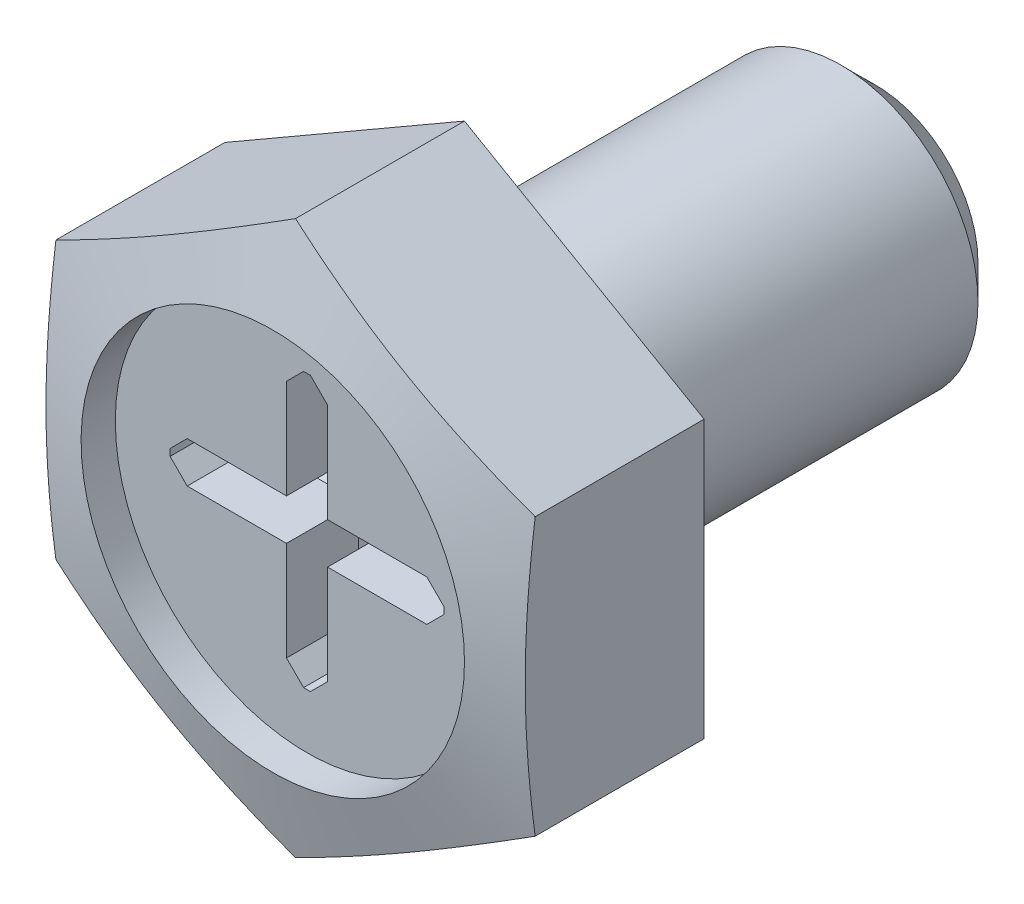
from build123d import *

# Parameters (mm, degrees)
EXTRUDE_1_DEPTH     = 2.8
SKETCH_3_R          = 2
EXTRUDE_3_DEPTH     = 6
SKETCH_7_R          = 2.8
CUT_EXTRUDE_3_DEPTH = 0.5
SKETCH_6_W          = 4
SKETCH_6_H          = 0.6
SKETCH_6_W_2        = 0.6
SKETCH_6_H_2        = 4
CUT_EXTRUDE_1_DEPTH = 1.3
CHAMFER_1_SIZE      = 0.5
FILLET_1_R          = 0.1
CHAMFER_2_SIZE      = 0.25
CHAMFER_3_SIZE      = 0.25


with BuildPart() as part:
    # 草图1 → 凸台-拉伸1 (new body)
    with BuildSketch(Plane.XY):
        Polygon((0, 4.041451884), (-3.5, 2.020725942), (-3.5, -2.020725942), (0, -4.041451884), (3.5, -2.020725942), (3.5, 2.020725942), align=None)
    extrude(amount=EXTRUDE_1_DEPTH)

    # 草图3 → 凸台-拉伸3 (add)
    with BuildSketch(Plane.XY):
        Circle(SKETCH_3_R)
    extrude(amount=-EXTRUDE_3_DEPTH)

    # 草图4 → 切除-旋转1 (revolve, cut)
    with BuildSketch(Plane(origin=(0, 0, 0), x_dir=(0, 0, -1), z_dir=(1, 0, 0)), mode=Mode.PRIVATE) as cut_revolve_1_sk:
        Polygon((-2.8, 14), (-2.8, 2.8), (0.201030955, 14), align=None)
    revolve(cut_revolve_1_sk.sketch.rotate(Axis((0, 0, -2.242017917), (0, 0, 1)), 90), axis=Axis((0, 0, -2.242017917), (0, 0, 1)), mode=Mode.SUBTRACT)

    # 草图7 → 切除-拉伸3 (cut)
    with BuildSketch(Plane.XY.offset(2.8)):
        Circle(SKETCH_7_R)
    extrude(amount=-CUT_EXTRUDE_3_DEPTH, mode=Mode.SUBTRACT)

    # 草图6 → 切除-拉伸1 (cut)
    with BuildSketch(Plane.XY.offset(2.3)):
        Rectangle(SKETCH_6_W, SKETCH_6_H)
        Rectangle(SKETCH_6_W_2, SKETCH_6_H_2)
    extrude(amount=-CUT_EXTRUDE_1_DEPTH, mode=Mode.SUBTRACT)

    # 倒角1
    chamfer_1_edges = [part.edges().sort_by_distance(p)[0] for p in [
        (-2, 0, -6),
    ]]
    chamfer(chamfer_1_edges, length=CHAMFER_1_SIZE)

    # 圆角1
    fillet_1_edges = [part.edges().sort_by_distance(p)[0] for p in [
        (-2, 0, 0),
    ]]
    fillet(fillet_1_edges, radius=FILLET_1_R)

    # 倒角2
    chamfer_2_edges = [part.edges().sort_by_distance(p)[0] for p in [
        (0.3, 1.15, 1),
        (1.15, 0.3, 1),
        (-0.3, -1.15, 1),
        (-2, 0, 1),
        (-1.15, 0.3, 1),
        (-0.3, 1.15, 1),
        (0, 2, 1),
        (0, -2, 1),
        (0.3, -1.15, 1),
        (-1.15, -0.3, 1),
        (2, 0, 1),
        (1.15, -0.3, 1),
    ]]
    chamfer(chamfer_2_edges, length=CHAMFER_2_SIZE)

    # 倒角3
    chamfer_3_edges = [part.edges().sort_by_distance(p)[0] for p in [
        (2, 0.3, 1.775),
        (2, -0.3, 1.775),
        (0.3, -2, 1.775),
        (-0.3, -2, 1.775),
        (-2, -0.3, 1.775),
        (-2, 0.3, 1.775),
        (-0.3, 2, 1.775),
        (0.3, 2, 1.775),
    ]]
    chamfer(chamfer_3_edges, length=CHAMFER_3_SIZE)


solid = part.part
